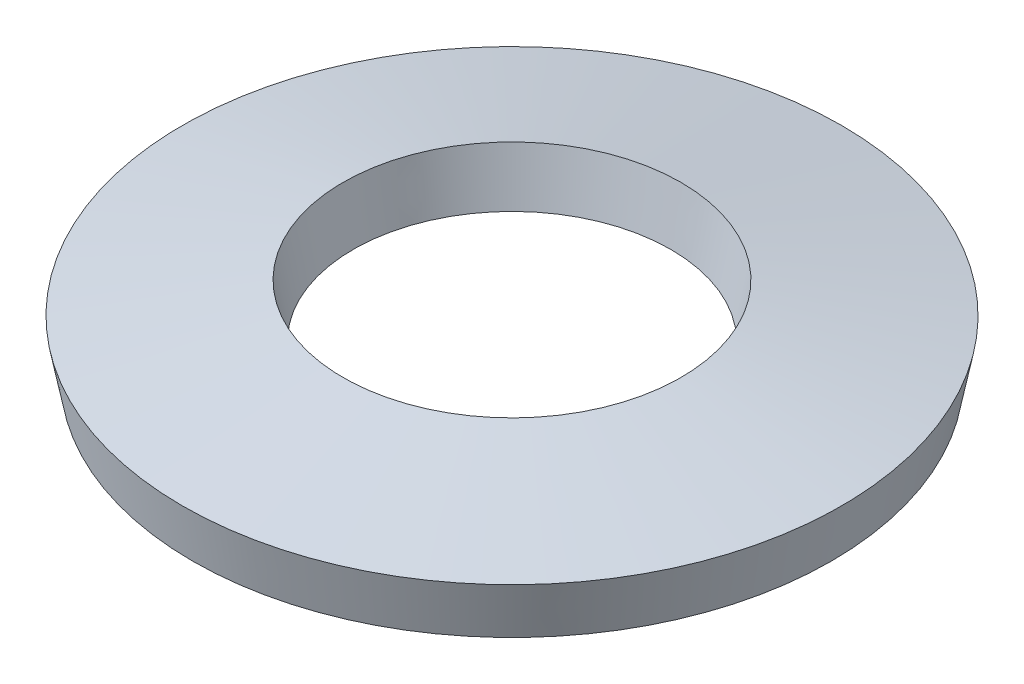
from build123d import *


with BuildPart() as part:
    # Sketch1 → Revolve1 (revolve)
    with BuildSketch(Plane.XY, mode=Mode.PRIVATE) as revolve1_sk:
        Polygon((5.329746589, 0), (2.65, 0.516250162), (2.820253411, 1.4), (5.5, 0.883749838), align=None)
    revolve(revolve1_sk.sketch.rotate(Axis((0, 0, 0), (0, 1, 0)), 90), axis=Axis((0, 0, 0), (0, 1, 0)))


solid = part.part
